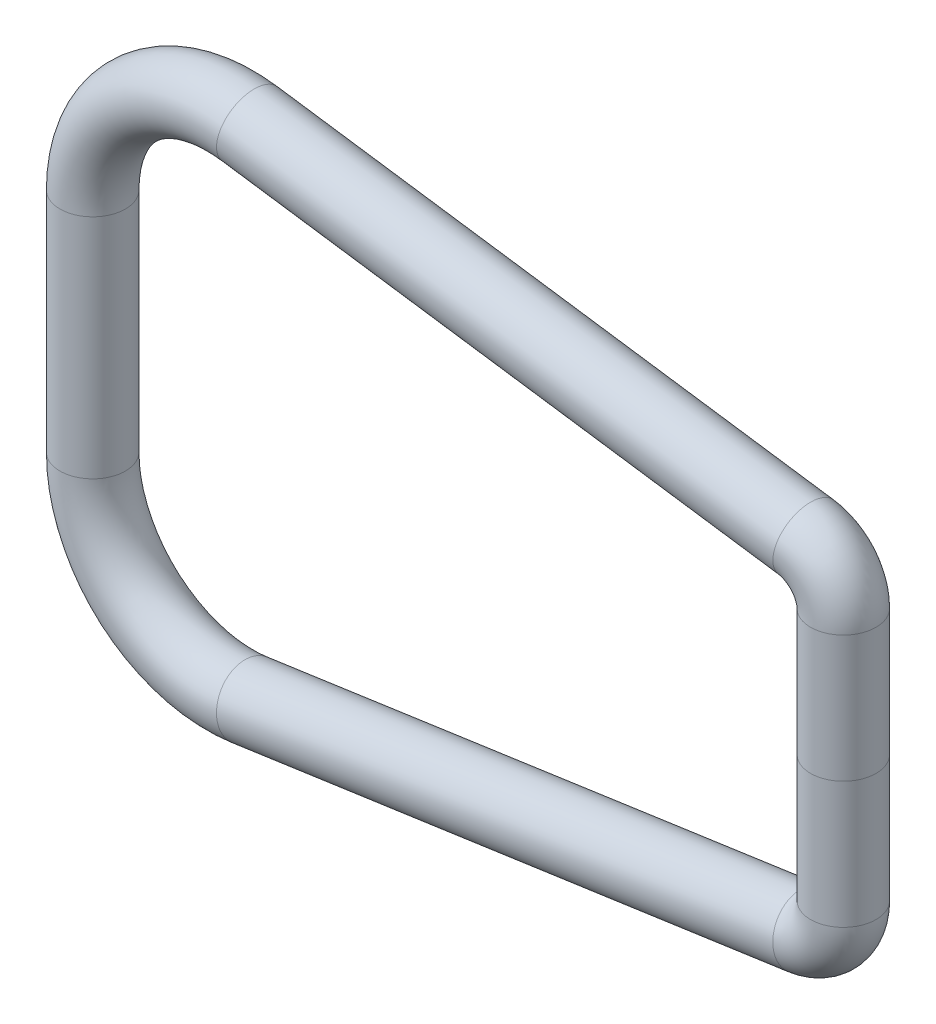
from build123d import *

# Parameters (mm, degrees)
SKETCH1_R = 0.9525


with BuildPart() as part:
    # Sweep1: sweep along a path in Sketch2
    with BuildLine(Plane.XY) as sweep1_path:
        Line((0, 3.683), (0, -3.683))
        ThreePointArc((0, -3.683), (-0.310403565, -4.514910261), (-1.089881388, -4.940162394))
        Line((-1.089881388, -4.940162394), (-17.278929773, -7.25963117))
        ThreePointArc((-17.278929773, -7.25963117), (-20.464864245, -6.322873659), (-21.844, -3.302))
        Line((-21.844, -3.302), (-21.844, 3.302))
        ThreePointArc((-21.844, 3.302), (-20.464864245, 6.322873659), (-17.278929773, 7.25963117))
        Line((-17.278929773, 7.25963117), (-1.089881388, 4.940162394))
        ThreePointArc((-1.089881388, 4.940162394), (-0.310403565, 4.514910261), (0, 3.683))
    # Sketch1 → Sweep1 (sweep)
    with BuildSketch(Plane(origin=(0, 0, 0), x_dir=(0, 0, -1), z_dir=(0, 1, 0))):
        Circle(SKETCH1_R)
    sweep(path=sweep1_path.line)


solid = part.part
